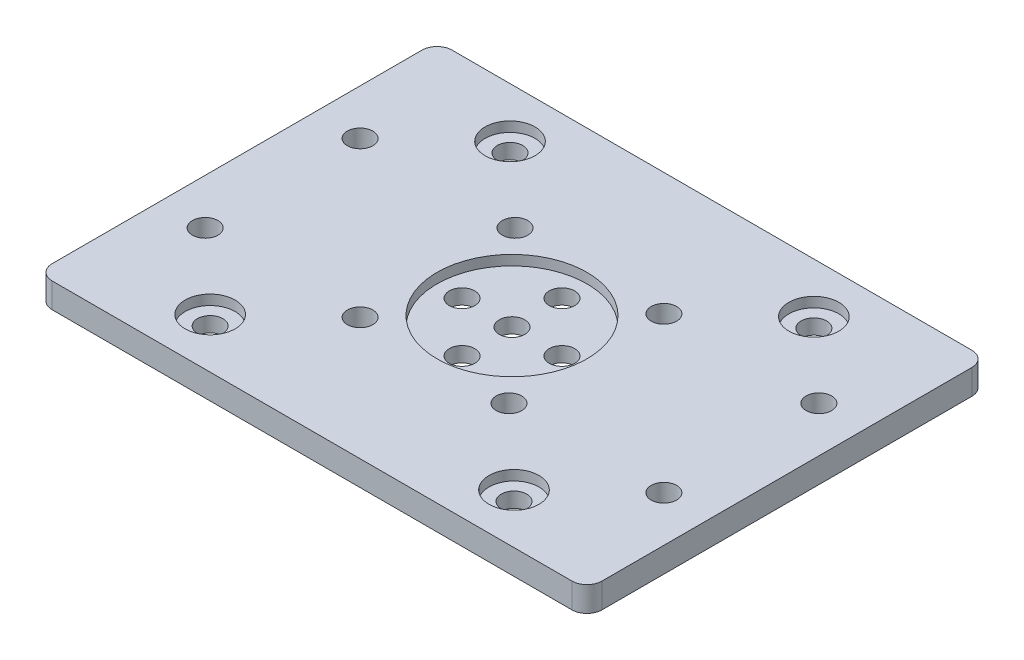
from build123d import *

# Parameters (mm, degrees)
SKETCH1_R           = 2.55
BOSS_EXTRUDE1_DEPTH = 5
SKETCH_1_R          = 5
SKETCH_1_R_2        = 15
CUT_EXTRUDE_1_DEPTH = 2


with BuildPart() as part:
    # Sketch1 → Boss-Extrude1 (new body)
    with BuildSketch(Plane(origin=(0, 0, 0), x_dir=(1, 0, 0), z_dir=(0, 1, 0))):
        with BuildLine():
            Line((52, -40), (-52, -40))
            ThreePointArc((-52, -40), (-54.121320344, -39.121320344), (-55, -37))
            Line((-55, -37), (-55, 37))
            ThreePointArc((-55, 37), (-54.121320344, 39.121320344), (-52, 40))
            Line((-52, 40), (52, 40))
            ThreePointArc((52, 40), (54.121320344, 39.121320344), (55, 37))
            Line((55, 37), (55, -37))
            ThreePointArc((55, -37), (54.121320344, -39.121320344), (52, -40))
        make_face()
        with Locations(Location((-30.395, 30, 0), (0, 0, 270))):
            Circle(SKETCH1_R, mode=Mode.SUBTRACT)
        with Locations(Location((0, 10, 0), (0, 0, 270))):
            Circle(SKETCH1_R, mode=Mode.SUBTRACT)
        with Locations(Location((0, 0, 0), (0, 0, 270))):
            Circle(SKETCH1_R, mode=Mode.SUBTRACT)
        with Locations(Location((10, 0, 0), (0, 0, 270))):
            Circle(SKETCH1_R, mode=Mode.SUBTRACT)
        with Locations(Location((-10, 0, 0), (0, 0, 90))):
            Circle(SKETCH1_R, mode=Mode.SUBTRACT)
        with Locations(Location((-45.895, 15.5, 0), (0, 0, 270))):
            Circle(SKETCH1_R, mode=Mode.SUBTRACT)
        with Locations(Location((30.4, 30, 0), (0, 0, 270))):
            Circle(SKETCH1_R, mode=Mode.SUBTRACT)
        with Locations(Location((0, -10, 0), (0, 0, 90))):
            Circle(SKETCH1_R, mode=Mode.SUBTRACT)
        with Locations(Location((-14.895, 15.5, 0), (0, 0, 270))):
            Circle(SKETCH1_R, mode=Mode.SUBTRACT)
        with Locations(Location((14.895, 15.5, 0), (0, 0, 90))):
            Circle(SKETCH1_R, mode=Mode.SUBTRACT)
        with Locations(Location((45.895, 15.5, 0), (0, 0, 90))):
            Circle(SKETCH1_R, mode=Mode.SUBTRACT)
        with Locations(Location((30.4, -30, 0), (0, 0, 90))):
            Circle(SKETCH1_R, mode=Mode.SUBTRACT)
        with Locations(Location((45.895, -15.5, 0), (0, 0, 270))):
            Circle(SKETCH1_R, mode=Mode.SUBTRACT)
        with Locations(Location((14.895, -15.5, 0), (0, 0, 270))):
            Circle(SKETCH1_R, mode=Mode.SUBTRACT)
        with Locations(Location((-14.895, -15.5, 0), (0, 0, 90))):
            Circle(SKETCH1_R, mode=Mode.SUBTRACT)
        with Locations(Location((-45.895, -15.5, 0), (0, 0, 90))):
            Circle(SKETCH1_R, mode=Mode.SUBTRACT)
        with Locations(Location((-30.395, -30, 0), (0, 0, 90))):
            Circle(SKETCH1_R, mode=Mode.SUBTRACT)
    extrude(amount=BOSS_EXTRUDE1_DEPTH)

    # 草圖1 → 除料-伸長1 (cut)
    with BuildSketch(Plane(origin=(0, 5, 0), x_dir=(1, 0, 0), z_dir=(0, 1, 0))):
        with Locations(Location((-30.395, -30, 0), (0, 0, 270))):
            Circle(SKETCH_1_R)
        with Locations(Location((-30.395, 30, 0), (0, 0, 270))):
            Circle(SKETCH_1_R)
        with Locations(Location((30.4, -30, 0), (0, 0, 270))):
            Circle(SKETCH_1_R)
        with Locations(Location((30.4, 30, 0), (0, 0, 270))):
            Circle(SKETCH_1_R)
        with Locations(Location((0, 0, 0), (0, 0, 270))):
            Circle(SKETCH_1_R_2)
    extrude(amount=-CUT_EXTRUDE_1_DEPTH, mode=Mode.SUBTRACT)


solid = part.part
